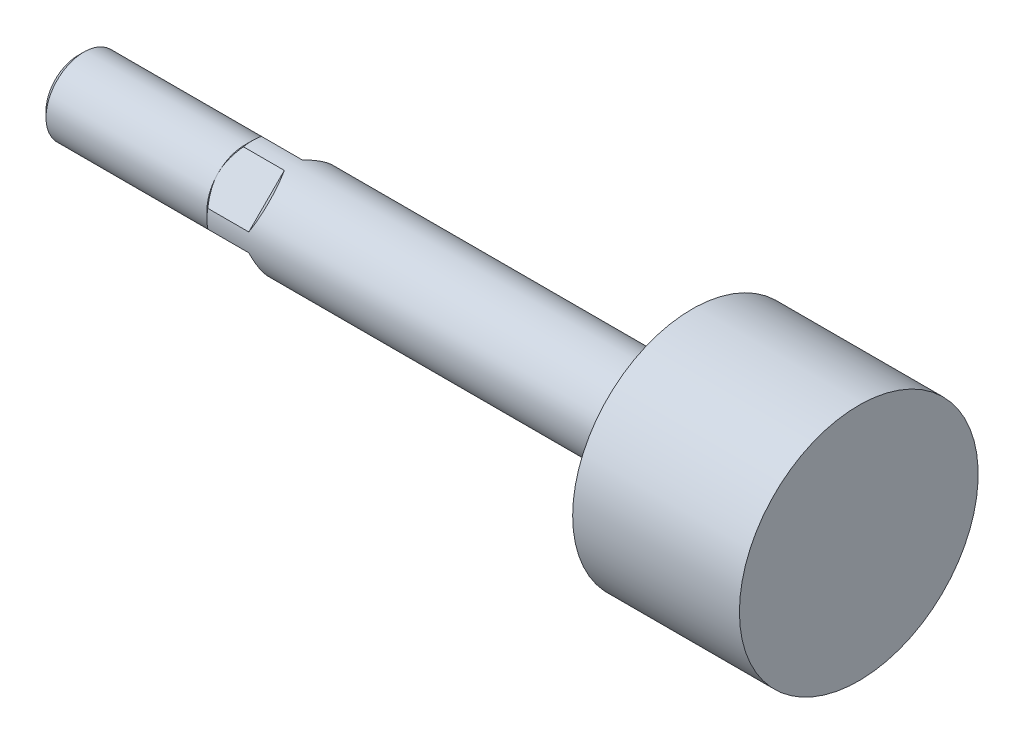
from build123d import *

# Parameters (mm, degrees)
CUT_EXTRUDE_1_DEPTH      = 5
CUT_EXTRUDE_1_DEPTH_BACK = 5
CUT_EXTRUDE_2_DEPTH      = 5
CUT_EXTRUDE_2_DEPTH_BACK = 5


with BuildPart() as part:
    # 草图1 → 旋转1 (revolve)
    with BuildSketch(Plane.XY):
        Polygon((0, 0), (0, 4.233), (0.767, 5), (22, 5), (23, 6), (81, 6), (81, 15.75), (103, 15.75), (103, 0), align=None)
    revolve(axis=Axis((103, 0, 0), (-1, 0, 0)))

    # 草图2 → 切除-拉伸1 (cut, two sides: drawn at the far end of the back side and taken through both)
    with BuildSketch(Plane(origin=(0, 0, 0), x_dir=(1, 0, 0), z_dir=(0, -0.7071067811865477, 0.7071067811865475)).offset(-CUT_EXTRUDE_1_DEPTH_BACK)):
        Polygon((-5, -12), (35.4, -12), (28.4, -5), (22, -5), (19.8, -7.2), (19.8, -10), (-3, -10), (-3, 10), (19.8, 10), (19.8, 7.2), (22, 5), (28.4, 5), (35.4, 12), (-5, 12), align=None)
    extrude(amount=CUT_EXTRUDE_1_DEPTH + CUT_EXTRUDE_1_DEPTH_BACK, mode=Mode.SUBTRACT)

    # 草图3 → 切除-拉伸2 (cut, two sides: drawn at the far end of the back side and taken through both)
    with BuildSketch(Plane(origin=(0, 0, 0), x_dir=(-1, 0, 0), z_dir=(0, -0.7071067811865477, -0.7071067811865475)).offset(-CUT_EXTRUDE_2_DEPTH_BACK)):
        Polygon((5, 12), (-35.4, 12), (-28.4, 5), (-22, 5), (-19.8, 7.2), (-19.8, 10), (3, 10), (3, -10), (-19.8, -10), (-19.8, -7.2), (-22, -5), (-28.4, -5), (-35.4, -12), (5, -12), align=None)
    extrude(amount=CUT_EXTRUDE_2_DEPTH + CUT_EXTRUDE_2_DEPTH_BACK, mode=Mode.SUBTRACT)


solid = part.part
